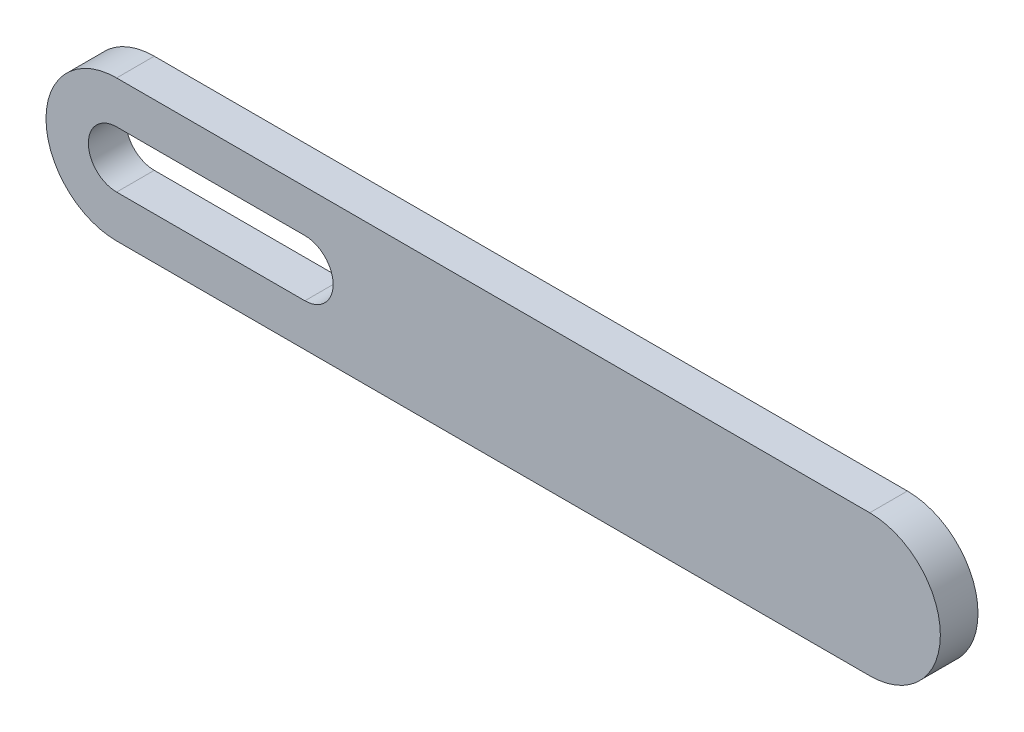
from build123d import *

# Parameters (mm, degrees)
EXTRUDE1_DEPTH = 20


with BuildPart() as part:
    # Sketch1 → Extrude1 (new body)
    with BuildSketch(Plane.XY):
        with BuildLine():
            Line((-50, 37.5), (350, 37.5))
            ThreePointArc((350, 37.5), (387.5, 0), (350, -37.5))
            Line((350, -37.5), (-50, -37.5))
            ThreePointArc((-50, -37.5), (-87.5, 0), (-50, 37.5))
        make_face()
        with BuildLine():
            Line((-50, 15), (50, 15))
            ThreePointArc((50, 15), (65, 0), (50, -15))
            Line((50, -15), (-50, -15))
            ThreePointArc((-50, -15), (-65, 0), (-50, 15))
        make_face(mode=Mode.SUBTRACT)
    extrude(amount=EXTRUDE1_DEPTH)


solid = part.part
